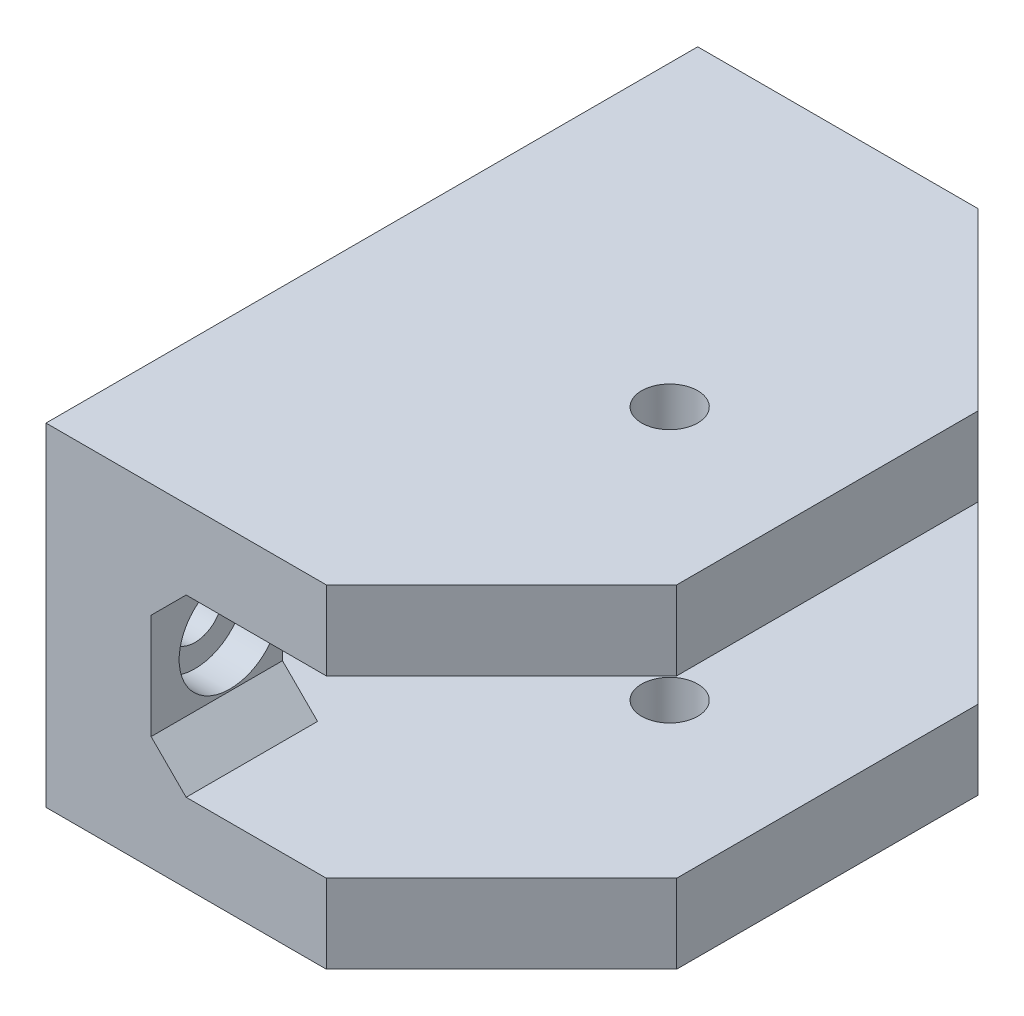
from build123d import *

# Parameters (mm, degrees)
SKETCH1_W           = 26
SKETCH1_H           = 37.2
BOSS_EXTRUDE1_DEPTH = 19
SKETCH2_W           = 20
SKETCH2_H           = 10
CUT_EXTRUDE1_DEPTH  = 77.929109018
SKETCH3_R           = 1.6
CUT_EXTRUDE2_DEPTH  = 76.699707134
CUT_EXTRUDE3_DEPTH  = 76.699707134
SKETCH7_W           = 22.2
SKETCH7_H           = 10
CUT_EXTRUDE6_DEPTH  = 45.240228818
SKETCH8_R           = 1.6
CUT_EXTRUDE7_DEPTH  = 45.240228818
CHAMFER1_SIZE       = 2
SKETCH9_R           = 2.9
CUT_EXTRUDE12_DEPTH = 2


with BuildPart() as part:
    # Sketch1 → Boss-Extrude1 (new body)
    with BuildSketch(Plane(origin=(0, 0, 0), x_dir=(1, 0, 0), z_dir=(0, 1, 0))):
        with Locations((51.600679674, -15.986093244)):
            Rectangle(SKETCH1_W, SKETCH1_H)
    extrude(amount=BOSS_EXTRUDE1_DEPTH)

    # Sketch2 → Cut-Extrude1 (cut, through all)
    with BuildSketch(Plane.XY.offset(34.586093244)):
        with Locations((54.600679674, 9.5)):
            Rectangle(SKETCH2_W, SKETCH2_H)
    extrude(amount=-CUT_EXTRUDE1_DEPTH, mode=Mode.SUBTRACT)

    # Sketch3 → Cut-Extrude2 (cut, through all)
    with BuildSketch(Plane.XZ):
        with Locations(Location((55.600679674, 15.986093244, 0), (0, 0, 270))):
            Circle(SKETCH3_R)
    extrude(amount=-CUT_EXTRUDE2_DEPTH, mode=Mode.SUBTRACT)

    # Sketch4 → Cut-Extrude3 (cut, through all)
    with BuildSketch(Plane.XZ):
        Polygon((64.600679674, 24.586093244), (54.600679674, 34.586093244), (64.600679674, 34.586093244), align=None)
        Polygon((64.600679674, 7.386093244), (54.600679674, -2.613906756), (64.600679674, -2.613906756), align=None)
    extrude(amount=-CUT_EXTRUDE3_DEPTH, mode=Mode.SUBTRACT)

    # Sketch7 → Cut-Extrude6 (cut, through all)
    with BuildSketch(Plane(origin=(44.600679674, 0, 0), x_dir=(0, 0, -1), z_dir=(1, 0, 0))):
        with Locations((-15.986093244, 9.5)):
            Rectangle(SKETCH7_W, SKETCH7_H)
    extrude(amount=-CUT_EXTRUDE6_DEPTH, mode=Mode.SUBTRACT)

    # Sketch8 → Cut-Extrude7 (cut, through all)
    with BuildSketch(Plane(origin=(44.600679674, 0, 0), x_dir=(0, 0, -1), z_dir=(1, 0, 0))):
        with Locations((-30.086093244, 9.5)):
            Circle(SKETCH8_R)
        with Locations((-1.886093244, 9.5)):
            Circle(SKETCH8_R)
    extrude(amount=-CUT_EXTRUDE7_DEPTH, mode=Mode.SUBTRACT)

    # Chamfer1
    chamfer1_edges = [part.edges().sort_by_distance(p)[0] for p in [
        (44.600679674, 4.5, 1.136093244),
        (44.600679674, 14.5, 1.136093244),
        (44.600679674, 14.5, 30.836093244),
        (44.600679674, 4.5, 30.836093244),
    ]]
    chamfer(chamfer1_edges, length=CHAMFER1_SIZE)

    # Sketch9 → Cut-Extrude12 (cut)
    with BuildSketch(Plane(origin=(44.600679674, 0, 0), x_dir=(0, 0, -1), z_dir=(1, 0, 0))):
        with Locations((-30.086093244, 9.5)):
            Circle(SKETCH9_R)
        with Locations((-1.886093244, 9.5)):
            Circle(SKETCH9_R)
    extrude(amount=-CUT_EXTRUDE12_DEPTH, mode=Mode.SUBTRACT)


solid = part.part
